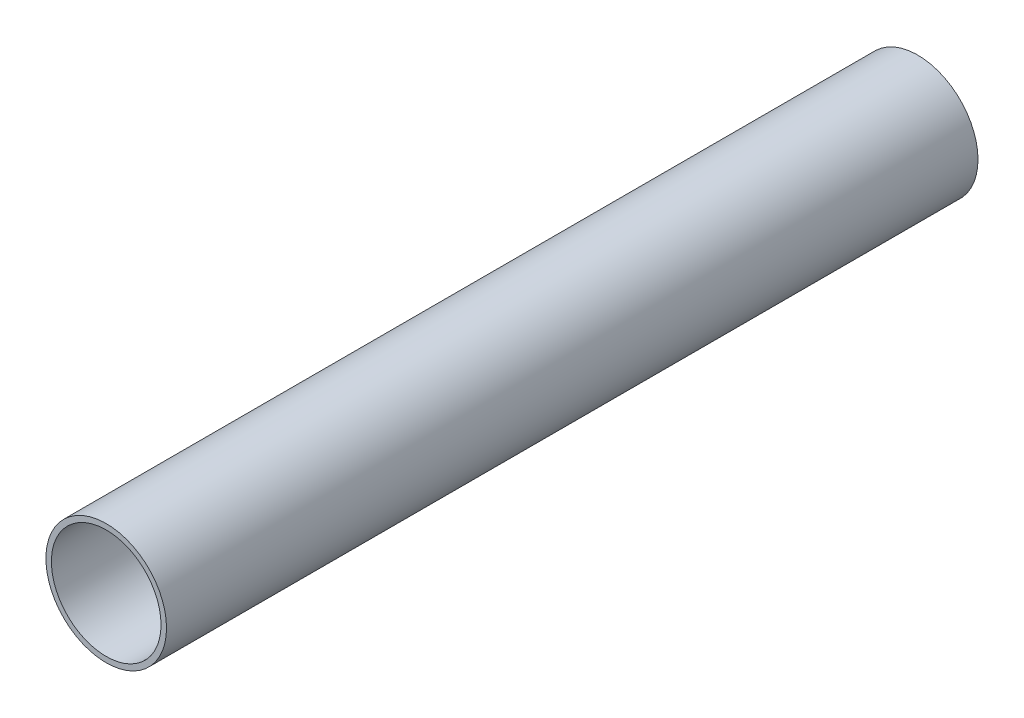
from build123d import *

# Parameters (mm, degrees)
SKETCH2_R           = 34.925
SKETCH2_R_2         = 31.75
BOSS_EXTRUDE1_DEPTH = 234.95


with BuildPart() as part:
    # Sketch2 → Boss-Extrude1 (new, symmetric)
    with BuildSketch(Plane.XY):
        Circle(SKETCH2_R)
        Circle(SKETCH2_R_2, mode=Mode.SUBTRACT)
    extrude(amount=BOSS_EXTRUDE1_DEPTH, both=True)


solid = part.part
